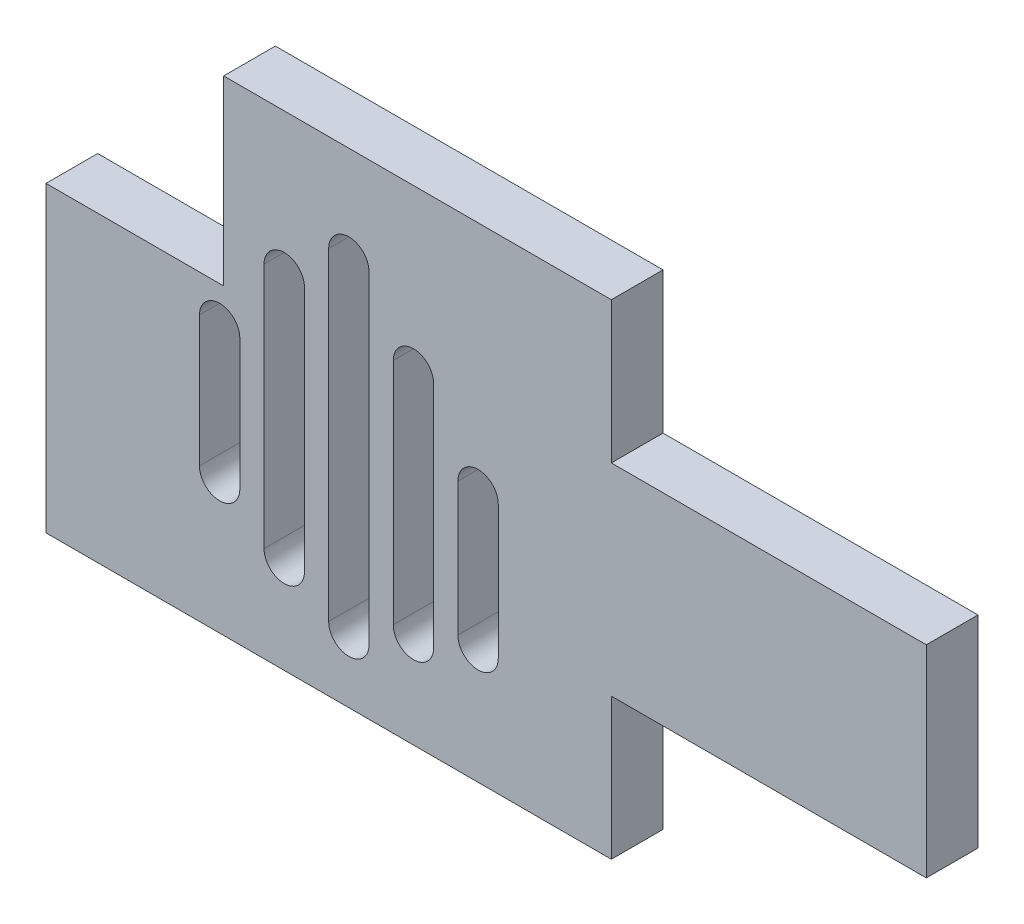
from build123d import *

# Parameters (mm, degrees)
BOSS_EXTRUDE1_DEPTH = 6.4


with BuildPart() as part:
    # Sketch1 → Boss-Extrude1 (new body)
    with BuildSketch(Plane.XY):
        Polygon((30.862718171, 33.494054131), (69.862718171, 33.494054131), (69.862718171, 8.494054131), (30.862718171, 8.494054131), (30.862718171, -9.005945869), (-39.137281829, -9.005945869), (-39.137281829, 28.472304637), (-17.137281829, 28.472304637), (-17.137281829, 50.994054131), (30.862718171, 50.994054131), align=None)
        with BuildLine():
            Line((-4.137281829, 38.994054131), (-4.137281829, -1.005945869))
            ThreePointArc((-4.137281829, -1.005945869), (-1.637281829, -3.505945869), (0.862718171, -1.005945869))
            Line((0.862718171, -1.005945869), (0.862718171, 38.994054131))
            ThreePointArc((0.862718171, 38.994054131), (-1.637281829, 41.494054131), (-4.137281829, 38.994054131))
        make_face(mode=Mode.SUBTRACT)
        with BuildLine():
            Line((-12.137281829, 33.312431903), (-12.137281829, 2.809827896))
            ThreePointArc((-12.137281829, 2.809827896), (-9.637281829, 0.309827896), (-7.137281829, 2.809827896))
            Line((-7.137281829, 2.809827896), (-7.137281829, 33.312431903))
            ThreePointArc((-7.137281829, 33.312431903), (-9.637281829, 35.812431903), (-12.137281829, 33.312431903))
        make_face(mode=Mode.SUBTRACT)
        with BuildLine():
            Line((-15.137281829, 23.861283589), (-15.137281829, 7.683449462))
            ThreePointArc((-15.137281829, 7.683449462), (-17.637281829, 5.183449462), (-20.137281829, 7.683449462))
            Line((-20.137281829, 7.683449462), (-20.137281829, 23.861283589))
            ThreePointArc((-20.137281829, 23.861283589), (-17.637281829, 26.361283589), (-15.137281829, 23.861283589))
        make_face(mode=Mode.SUBTRACT)
        with BuildLine():
            Line((3.862718171, 30.994054131), (3.862718171, 2.647434443))
            ThreePointArc((3.862718171, 2.647434443), (6.362718171, 0.147434443), (8.862718171, 2.647434443))
            Line((8.862718171, 2.647434443), (8.862718171, 30.994054131))
            ThreePointArc((8.862718171, 30.994054131), (6.362718171, 33.494054131), (3.862718171, 30.994054131))
        make_face(mode=Mode.SUBTRACT)
        with BuildLine():
            Line((11.862718171, 22.048271006), (11.862718171, 5.538473012))
            ThreePointArc((11.862718171, 5.538473012), (14.362718171, 3.038473012), (16.862718171, 5.538473012))
            Line((16.862718171, 5.538473012), (16.862718171, 22.048271006))
            ThreePointArc((16.862718171, 22.048271006), (14.362718171, 24.548271006), (11.862718171, 22.048271006))
        make_face(mode=Mode.SUBTRACT)
    extrude(amount=BOSS_EXTRUDE1_DEPTH)


solid = part.part
